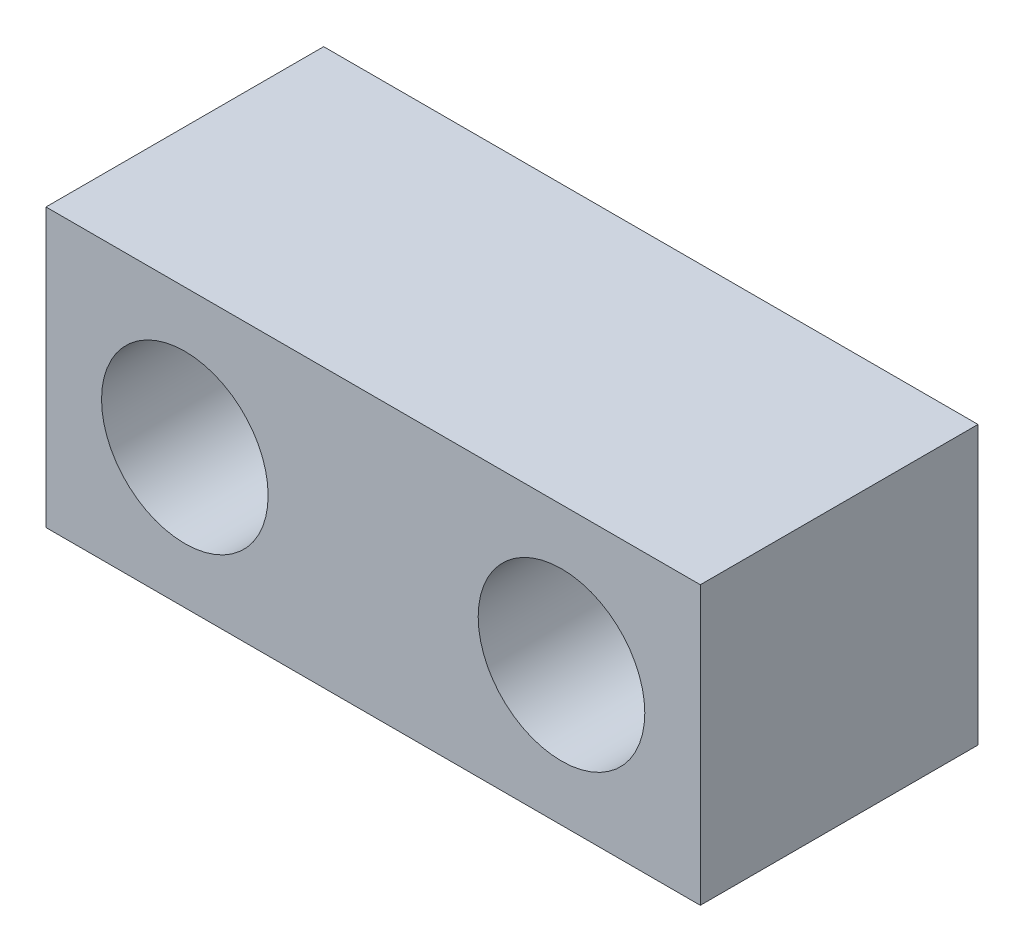
from build123d import *

# Parameters (mm, degrees)
SKETCH1_W                  = 47.129705535
SKETCH1_H                  = 20
EXTRUDE1_DEPTH             = 20
F_12_0_12_DIAMETER_HOLE1_D = 12


with BuildPart() as part:
    # Sketch1 → Extrude1 (new body)
    with BuildSketch(Plane.XY):
        with Locations((23.564852768, 10)):
            Rectangle(SKETCH1_W, SKETCH1_H)
    extrude(amount=EXTRUDE1_DEPTH)

    # Ø12.0 (12) Diameter Hole1 (through all)
    with Locations(Plane(origin=(37.129705535, 10, 20), x_dir=(1, 0, 0), z_dir=(0, 0, 1))):
        with Locations((0, 0), (-27.129705535, 0)):
            Hole(F_12_0_12_DIAMETER_HOLE1_D / 2)


solid = part.part
